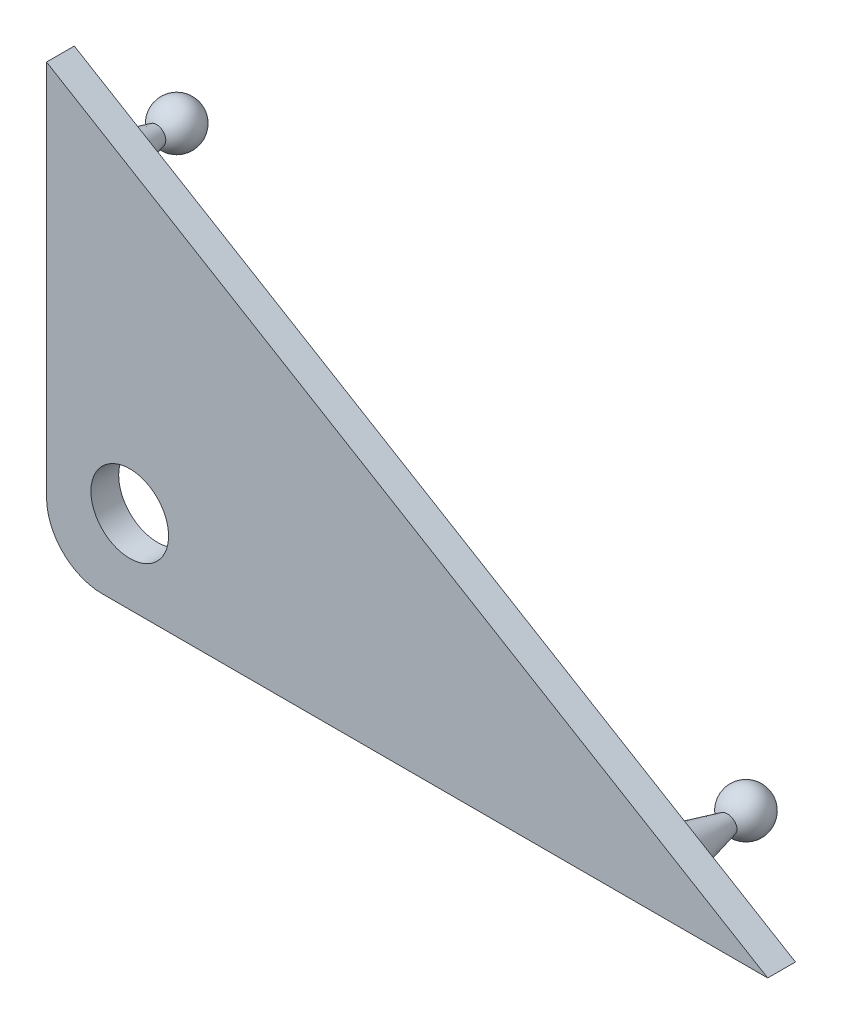
from build123d import *

# Parameters (mm, degrees)
ESTRUSIONE_ESTRUSIONE1_DEPTH = 5
SCHIZZO2_R                   = 7
TAGLIO_ESTRUSIONE1_DEPTH     = 152.6871781
RACCORDO1_R                  = 10
SCHIZZO10_R                  = 4
ESTRUSIONE_ESTRUSIONE2_DEPTH = 10
ESTRUSIONE_ESTRUSIONE2_TAPER = 14
SCHIZZO13_R                  = 4
ESTRUSIONE_ESTRUSIONE3_DEPTH = 10
ESTRUSIONE_ESTRUSIONE3_TAPER = 14


with BuildPart() as part:
    # Schizzo1 → Estrusione-Estrusione1 (new body)
    with BuildSketch(Plane.XY):
        Polygon((0, 0), (0, 78), (130, 0), align=None)
    extrude(amount=ESTRUSIONE_ESTRUSIONE1_DEPTH)

    # Schizzo2 → Taglio-Estrusione1 (cut, through all)
    with BuildSketch(Plane(origin=(0, 0, 0), x_dir=(-1, 0, 0), z_dir=(0, 0, -1))):
        with Locations((-15, 15)):
            Circle(SCHIZZO2_R)
    extrude(amount=-TAGLIO_ESTRUSIONE1_DEPTH, mode=Mode.SUBTRACT)

    # Raccordo1
    raccordo1_edges = [part.edges().sort_by_distance(p)[0] for p in [
        (0, 0, 2.5),
    ]]
    fillet(raccordo1_edges, radius=RACCORDO1_R)

    # Schizzo10 → Estrusione-Estrusione2 (add)
    with BuildSketch(Plane(origin=(0, 0, 0), x_dir=(-1, 0, 0), z_dir=(0, 0, -1))):
        with Locations((-5.463985213, 62.137606809)):
            Circle(SCHIZZO10_R)
    extrude(amount=ESTRUSIONE_ESTRUSIONE2_DEPTH, taper=ESTRUSIONE_ESTRUSIONE2_TAPER)

    # Schizzo12 → Rivoluzione1 (revolve)
    with BuildSketch(Plane.ZY.offset(-5.463985213)):
        with BuildLine():
            Line((-13, 58.137606809), (-13, 66.137606809))
            ThreePointArc((-13, 66.137606809), (-9, 62.137606809), (-13, 58.137606809))
        make_face()
    revolve(axis=Axis((5.463985213, 58.137606809, -13), (0, 1, 0)))

    # Schizzo13 → Estrusione-Estrusione3 (add)
    with BuildSketch(Plane(origin=(0, 0, 0), x_dir=(-1, 0, 0), z_dir=(0, 0, -1))):
        with Locations((-108.33809621, 6)):
            Circle(SCHIZZO13_R)
    extrude(amount=ESTRUSIONE_ESTRUSIONE3_DEPTH, taper=ESTRUSIONE_ESTRUSIONE3_TAPER)

    # Schizzo15 → Rivoluzione2 (revolve)
    with BuildSketch(Plane(origin=(31.324790173, 52.207983622, 0), x_dir=(0.8574929257125442, -0.5144957554275265, 0), z_dir=(0.5144957554275265, 0.8574929257125442, 0))):
        with BuildLine():
            Line((85.508399812, 13), (93.508399812, 13))
            ThreePointArc((93.508399812, 13), (89.508399812, 9), (85.508399812, 13))
        make_face()
    revolve(axis=Axis((104.647638101, 8.214274866, -13), (0.8574929257125445, -0.5144957554275261, 0)))


solid = part.part
